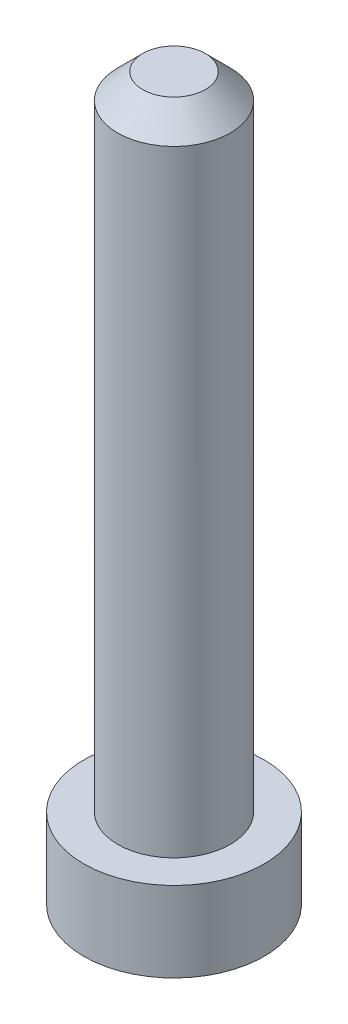
from build123d import *

# Parameters (mm, degrees)
CHAMFER1_SIZE = 0.254


with BuildPart() as part:
    # Sketch1 → Revolve1 (revolve)
    with BuildSketch(Plane.XY, mode=Mode.PRIVATE) as revolve1_sk:
        Polygon((0.9144, 0.8128), (0.5715, 0.8128), (0.5715, 7.3152), (0, 7.3152), (0, 0), (0.9144, 0), align=None)
    revolve(revolve1_sk.sketch.rotate(Axis((0, 7.3152, 0), (0, -1, 0)), 90), axis=Axis((0, 7.3152, 0), (0, -1, 0)))

    # Chamfer1
    chamfer1_edges = [part.edges().sort_by_distance(p)[0] for p in [
        (0, 7.3152, -0.5715),
    ]]
    chamfer(chamfer1_edges, length=CHAMFER1_SIZE)


solid = part.part
